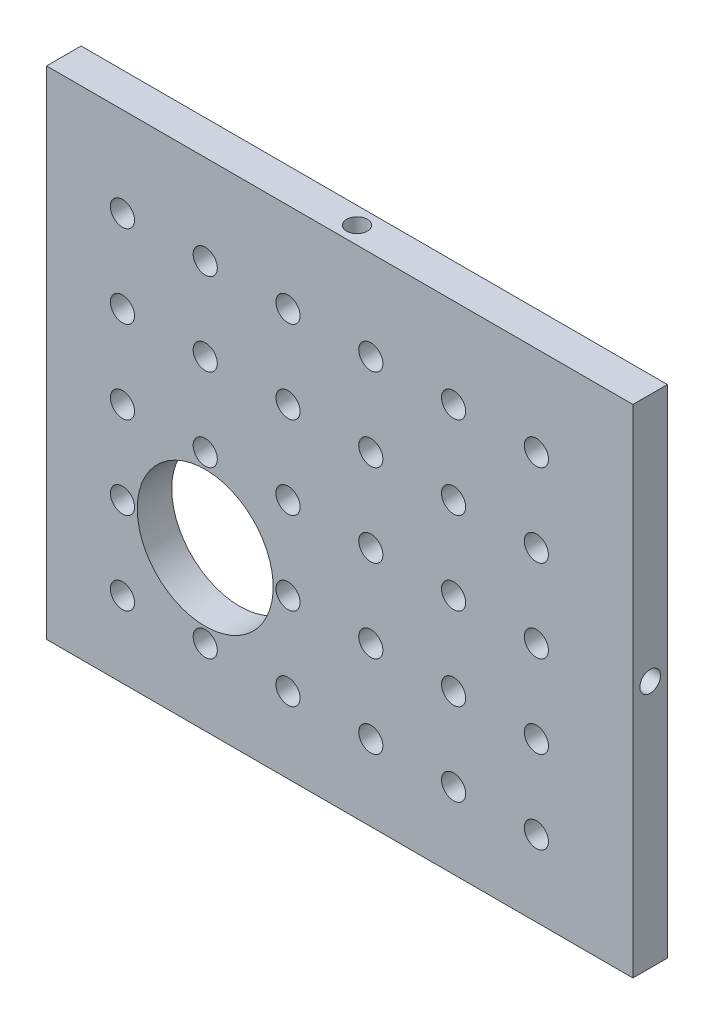
from build123d import *

# Parameters (mm, degrees)
ESQUISSE1_W                     = 85
ESQUISSE1_H                     = 72
BOSS_EXTRU_1_DEPTH              = 5
ESQUISSE3_R                     = 1.5
ENL_V_MAT_EXTRU_5_DEPTH         = 5
ESQUISSE5_R                     = 1.75
ENL_V_MAT_EXTRU_6_DEPTH         = 5
R_P_TITION_LIN_AIRE2_COUNT      = 6
R_P_TITION_LIN_AIRE2_PITCH      = 12
R_P_TITION_LIN_AIRE2_COUNT_DIR2 = 5
R_P_TITION_LIN_AIRE2_PITCH_DIR2 = 12
ESQUISSE6_R                     = 9.852345932
ENL_V_MAT_EXTRU_7_DEPTH         = 5
ESQUISSE8_R                     = 1.5
ENL_V_MAT_EXTRU_8_DEPTH         = 5


with BuildPart() as part:
    # Esquisse1 → Boss.-Extru.1 (new body)
    with BuildSketch(Plane.XY):
        Rectangle(ESQUISSE1_W, ESQUISSE1_H)
    extrude(amount=BOSS_EXTRU_1_DEPTH)

    # Esquisse3 → Enlèv. mat.-Extru.5 (cut)
    with BuildSketch(Plane.ZY.offset(42.5)):
        with Locations((2.5, 0)):
            Circle(ESQUISSE3_R)
    enl_v_mat_extru_5 = extrude(amount=-ENL_V_MAT_EXTRU_5_DEPTH, mode=Mode.SUBTRACT)

    # Symétrie1: Enlèv. mat.-Extru.5 across plane
    add(enl_v_mat_extru_5.mirror(Plane(origin=(0, 0, 0), x_dir=(0, 0, 1), z_dir=(1, 0, 0))), mode=Mode.SUBTRACT)

    # Esquisse5 → Enlèv. mat.-Extru.6 (cut)
    with BuildSketch(Plane.XY):
        with Locations(Location((-31.5, -25, 0), (0, 0, 180))):
            Circle(ESQUISSE5_R)
    enl_v_mat_extru_6 = extrude(amount=ENL_V_MAT_EXTRU_6_DEPTH, mode=Mode.SUBTRACT)

    # Répétition linéaire2: Enl_v. mat.-Extru.6 6 × 5
    with Locations(*[(i * R_P_TITION_LIN_AIRE2_PITCH, j * R_P_TITION_LIN_AIRE2_PITCH_DIR2, 0) for i in range(R_P_TITION_LIN_AIRE2_COUNT) for j in range(R_P_TITION_LIN_AIRE2_COUNT_DIR2) if (i, j) != (0, 0)]):
        add(enl_v_mat_extru_6, mode=Mode.SUBTRACT)

    # Esquisse6 → Enlèv. mat.-Extru.7 (cut)
    with BuildSketch(Plane.XY):
        with Locations(Location((-19.5, -13, 0), (0, 0, 180))):
            Circle(ESQUISSE6_R)
    extrude(amount=ENL_V_MAT_EXTRU_7_DEPTH, mode=Mode.SUBTRACT)

    # Esquisse8 → Enlèv. mat.-Extru.8 (cut)
    with BuildSketch(Plane(origin=(0, 36, 0), x_dir=(1, 0, 0), z_dir=(0, 1, 0))):
        with Locations(Location((0, -2.5, 0), (0, 0, 270))):
            Circle(ESQUISSE8_R)
    enl_v_mat_extru_8 = extrude(amount=-ENL_V_MAT_EXTRU_8_DEPTH, mode=Mode.SUBTRACT)

    # Symétrie2: Enlèv. mat.-Extru.8 across plane
    add(enl_v_mat_extru_8.mirror(Plane.ZX), mode=Mode.SUBTRACT)


solid = part.part
